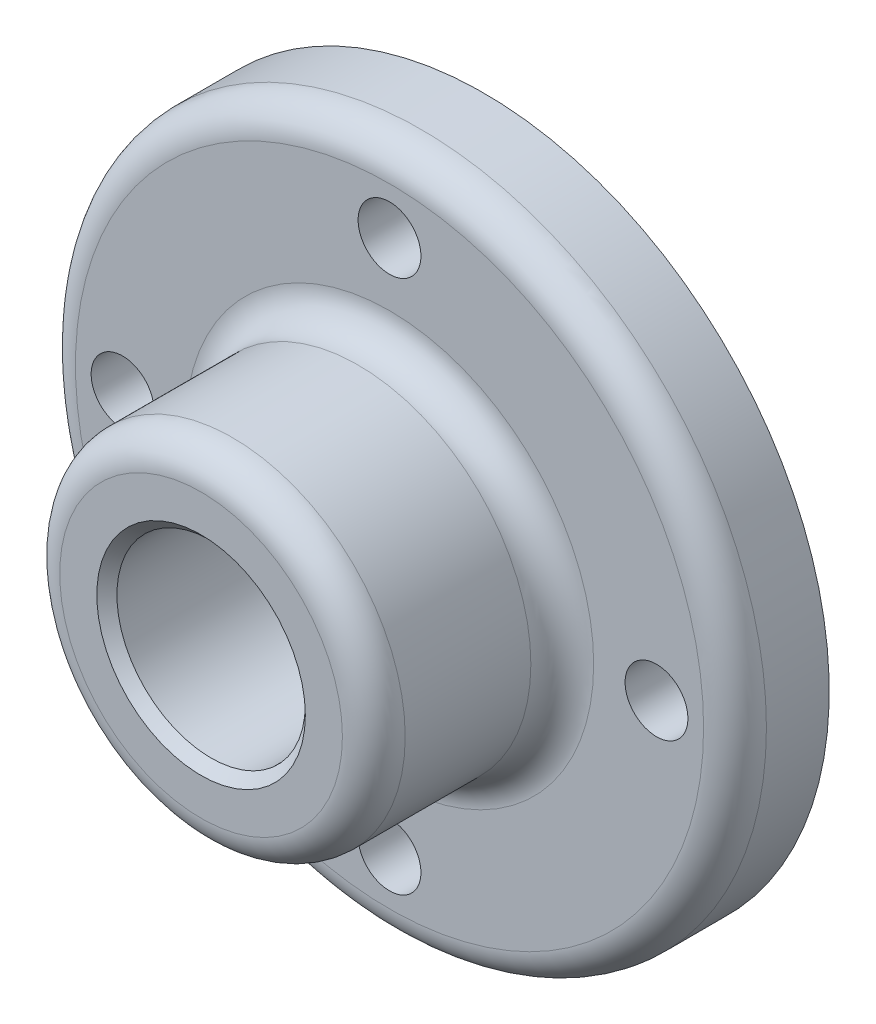
from build123d import *

# Parameters (mm, degrees)
SKETCH1_R           = 69.85
BOSS_EXTRUDE1_DEPTH = 19.05
SKETCH2_R           = 34.925
BOSS_EXTRUDE2_DEPTH = 38.1
SKETCH3_R           = 19.05
CUT_EXTRUDE1_DEPTH  = 115.123474798
SKETCH4_R           = 6.35
CUT_EXTRUDE2_DEPTH  = 106.875658203
FILLET1_R           = 6.35
CHAMFER1_SIZE       = 2.032


with BuildPart() as part:
    # Sketch1 → Boss-Extrude1 (new body)
    with BuildSketch(Plane.XY):
        with Locations(Location((0, 0, 0), (0, 0, 180))):
            Circle(SKETCH1_R)
    extrude(amount=BOSS_EXTRUDE1_DEPTH)

    # Sketch2 → Boss-Extrude2 (add)
    with BuildSketch(Plane.XY.offset(57.15)):
        Circle(SKETCH2_R)
    extrude(amount=-BOSS_EXTRUDE2_DEPTH)

    # Sketch3 → Cut-Extrude1 (cut, through all)
    with BuildSketch(Plane.XY.offset(57.15)):
        Circle(SKETCH3_R)
    extrude(amount=-CUT_EXTRUDE1_DEPTH, mode=Mode.SUBTRACT)

    # Sketch4 → Cut-Extrude2 (cut, through all)
    with BuildSketch(Plane.XY.offset(19.05)):
        with Locations((0, 53.975)):
            Circle(SKETCH4_R)
        with Locations((53.975, 0)):
            Circle(SKETCH4_R)
        with Locations((0, -53.975)):
            Circle(SKETCH4_R)
        with Locations((-53.975, 0)):
            Circle(SKETCH4_R)
    extrude(amount=-CUT_EXTRUDE2_DEPTH, mode=Mode.SUBTRACT)

    # Fillet1
    fillet1_edges = [part.edges().sort_by_distance(p)[0] for p in [
        (69.85, 0, 19.05),
        (-34.925, 0, 57.15),
        (-34.925, 0, 19.05),
    ]]
    fillet(fillet1_edges, radius=FILLET1_R)

    # Chamfer1
    chamfer1_edges = [part.edges().sort_by_distance(p)[0] for p in [
        (-19.05, 0, 57.15),
    ]]
    chamfer(chamfer1_edges, length=CHAMFER1_SIZE)


solid = part.part
